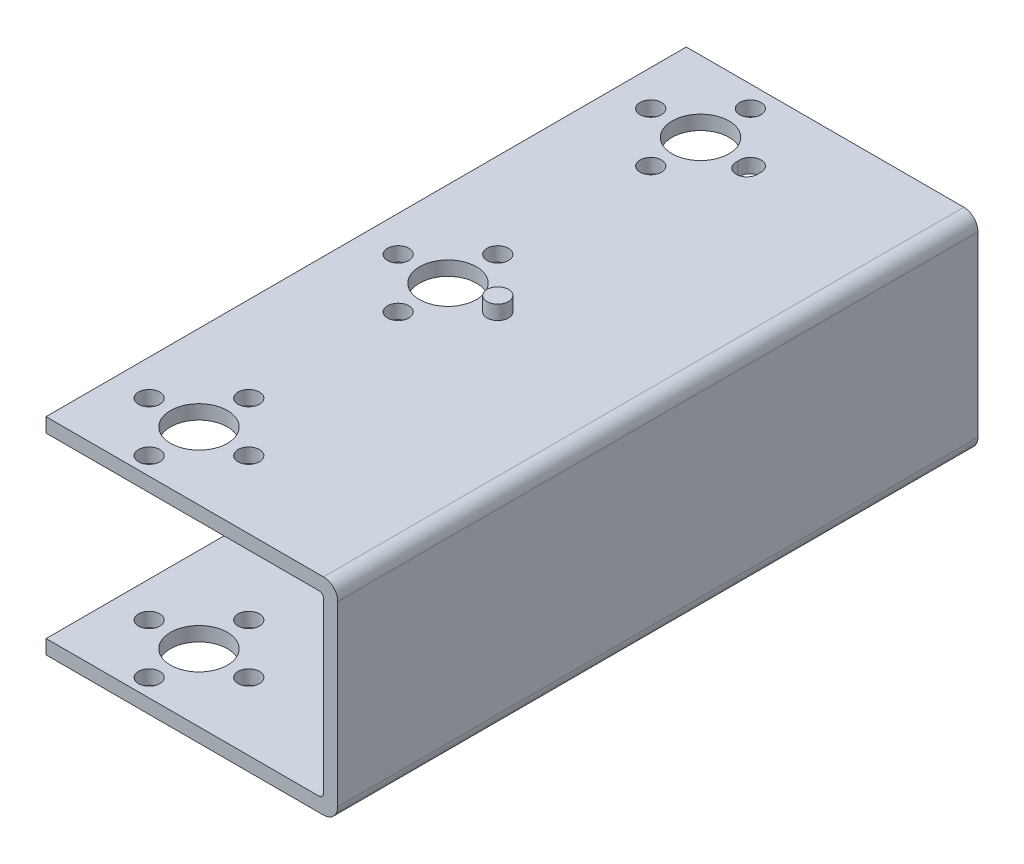
from build123d import *

# Parameters (mm, degrees)
BOSS_EXTRUDE1_DEPTH = 90
SKETCH4_R           = 1.5
SKETCH4_R_2         = 4
CUT_EXTRUDE1_DEPTH  = 31
SKETCH6_R           = 4
SKETCH6_R_2         = 1.5
CUT_EXTRUDE2_DEPTH  = 31
SKETCH7_R           = 1.5
BOSS_EXTRUDE2_DEPTH = 2


with BuildPart() as part:
    # Sketch3 → Boss-Extrude1 (new body)
    with BuildSketch(Plane.XY):
        with BuildLine():
            Line((-2, 0.049393959), (-41, 0.049393959))
            Line((-41, 0.049393959), (-41, 2.049393959))
            Line((-41, 2.049393959), (-2.618272552, 2.049393959))
            ThreePointArc((-2.618272552, 2.049393959), (-2.194008483, 2.22512989), (-2.018272552, 2.649393959))
            Line((-2.018272552, 2.649393959), (-2.018272552, 26.449393959))
            ThreePointArc((-2.018272552, 26.449393959), (-2.194008483, 26.873658027), (-2.618272552, 27.049393959))
            Line((-2.618272552, 27.049393959), (-41.018189082, 27.049393959))
            Line((-41.018189082, 27.049393959), (-41.018189082, 29.049393959))
            Line((-41.018189082, 29.049393959), (-2.018189082, 29.049393959))
            ThreePointArc((-2.018189082, 29.049393959), (-0.60397552, 28.463607521), (-0.018189082, 27.049393959))
            Line((-0.018189082, 27.049393959), (-0.018189082, 2.049393959))
            ThreePointArc((-0.018189082, 2.049393959), (-0.597554333, 0.64159652), (-2, 0.049393959))
        make_face()
    extrude(amount=BOSS_EXTRUDE1_DEPTH)

    # Sketch4 → Cut-Extrude1 (cut)
    with BuildSketch(Plane(origin=(0, 29.049393959, 0), x_dir=(1, 0, 0), z_dir=(0, 1, 0))):
        with Locations(Location((-29.018189082, -3, 0), (0, 0, 180))):
            Circle(SKETCH4_R)
        with Locations(Location((-36.018189082, -10, 0), (0, 0, 180))):
            Circle(SKETCH4_R)
        with Locations(Location((-29.018189082, -10, 0), (0, 0, 180))):
            Circle(SKETCH4_R_2)
        with Locations(Location((-22.018189082, -10, 0), (0, 0, 180))):
            Circle(SKETCH4_R)
        with Locations(Location((-29.018189082, -17, 0), (0, 0, 180))):
            Circle(SKETCH4_R)
    extrude(amount=-CUT_EXTRUDE1_DEPTH, mode=Mode.SUBTRACT)

    # Sketch6 → Cut-Extrude2 (cut)
    with BuildSketch(Plane(origin=(0, 29.049393959, 0), x_dir=(1, 0, 0), z_dir=(0, 1, 0))):
        with Locations(Location((-29.018189082, -45.498892055, 0), (0, 0, 180))):
            Circle(SKETCH6_R)
        with Locations(Location((-29.018189082, -80.498892055, 0), (0, 0, 180))):
            Circle(SKETCH6_R)
        with Locations(Location((-36.018189082, -45.498892055, 0), (0, 0, 180))):
            Circle(SKETCH6_R_2)
        with Locations(Location((-36.018189082, -80.498892055, 0), (0, 0, 180))):
            Circle(SKETCH6_R_2)
        with Locations((5.981810918, -52.498892055)):
            Circle(SKETCH6_R_2)
        with Locations(Location((-29.018189082, -52.498892055, 0), (0, 0, 180))):
            Circle(SKETCH6_R_2)
        with Locations((-22.018189082, -10.498892055)):
            Circle(SKETCH6_R_2)
        with Locations(Location((-22.018189082, -45.498892055, 0), (0, 0, 180))):
            Circle(SKETCH6_R_2)
        with Locations((-64.018189082, -38.498892055)):
            Circle(SKETCH6_R_2)
        with Locations(Location((-29.018189082, -38.498892055, 0), (0, 0, 180))):
            Circle(SKETCH6_R_2)
        with Locations(Location((-29.018189082, -73.498892055, 0), (0, 0, 180))):
            Circle(SKETCH6_R_2)
        with Locations(Location((-22.018189082, -80.498892055, 0), (0, 0, 180))):
            Circle(SKETCH6_R_2)
        with Locations(Location((-29.018189082, -87.498892055, 0), (0, 0, 180))):
            Circle(SKETCH6_R_2)
    extrude(amount=-CUT_EXTRUDE2_DEPTH, mode=Mode.SUBTRACT)


with BuildPart() as body_2:
    # Sketch7 → Boss-Extrude2 (new body)
    with BuildSketch(Plane(origin=(0, 29.049393959, 0), x_dir=(1, 0, 0), z_dir=(0, 1, 0))):
        with Locations(Location((-22.018189082, -45.498892055, 0), (0, 0, 180))):
            Circle(SKETCH7_R)
    extrude(amount=BOSS_EXTRUDE2_DEPTH)


solid = Compound([part.part, body_2.part])
